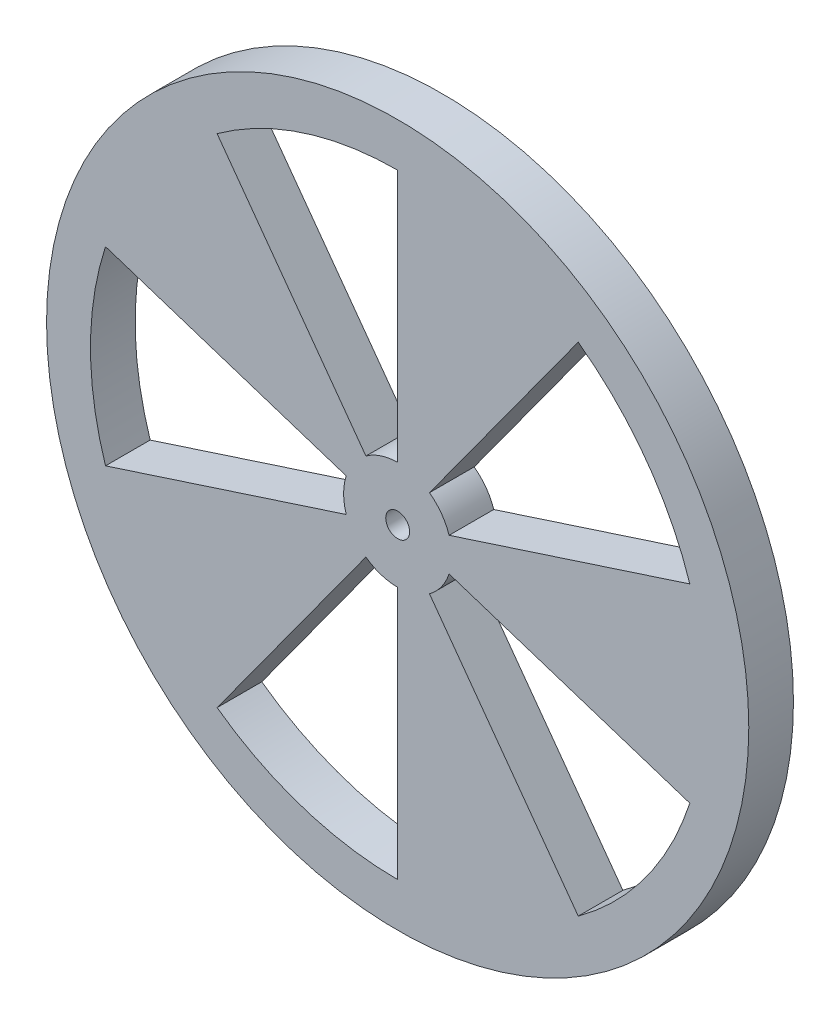
from build123d import *

# Parameters (mm, degrees)
SKETCH1_R           = 25
SKETCH1_R_2         = 0.85
BOSS_EXTRUDE1_DEPTH = 3.18
CUT_EXTRUDE1_DEPTH  = 36.498061919


with BuildPart() as part:
    # Sketch1 → Boss-Extrude1 (new body)
    with BuildSketch(Plane.XY):
        with Locations(Location((0, 0, 0), (0, 0, 180))):
            Circle(SKETCH1_R)
        with Locations(Location((0, 0, 0), (0, 0, 180))):
            Circle(SKETCH1_R_2, mode=Mode.SUBTRACT)
    extrude(amount=BOSS_EXTRUDE1_DEPTH)

    # Sketch2 → Cut-Extrude1 (cut, through all)
    with BuildSketch(Plane.XY.offset(3.18)):
        with BuildLine():
            ThreePointArc((-2.262973221, 3.114715428), (-1.189715428, 3.661567588), (0, 3.85))
            Line((0, 3.85), (0, 21.87181707))
            ThreePointArc((0, 21.87181707), (-6.758763172, 20.801334147), (-12.855931514, 17.694671707))
            Line((-12.855931514, 17.694671707), (-2.262973221, 3.114715428))
        make_face()
        with BuildLine():
            Line((12.855931514, 17.694671707), (2.262973221, 3.114715428))
            ThreePointArc((2.262973221, 3.114715428), (3.114715428, 2.262973221), (3.661567588, 1.189715428))
            Line((3.661567588, 1.189715428), (20.801334147, 6.758763172))
            ThreePointArc((20.801334147, 6.758763172), (17.694671707, 12.855931514), (12.855931514, 17.694671707))
        make_face()
        with BuildLine():
            ThreePointArc((-3.661567588, -1.189715428), (-3.85, 0), (-3.661567588, 1.189715428))
            Line((-3.661567588, 1.189715428), (-20.801334147, 6.758763172))
            ThreePointArc((-20.801334147, 6.758763172), (-21.87181707, 0), (-20.801334147, -6.758763172))
            Line((-20.801334147, -6.758763172), (-3.661567588, -1.189715428))
        make_face()
        with BuildLine():
            Line((20.801334147, -6.758763172), (3.661567588, -1.189715428))
            ThreePointArc((3.661567588, -1.189715428), (3.114715428, -2.262973221), (2.262973221, -3.114715428))
            Line((2.262973221, -3.114715428), (12.855931514, -17.694671707))
            ThreePointArc((12.855931514, -17.694671707), (17.694671707, -12.855931514), (20.801334147, -6.758763172))
        make_face()
        with BuildLine():
            ThreePointArc((0, -3.85), (-1.189715428, -3.661567588), (-2.262973221, -3.114715428))
            Line((-2.262973221, -3.114715428), (-12.855931514, -17.694671707))
            ThreePointArc((-12.855931514, -17.694671707), (-6.758763172, -20.801334147), (0, -21.87181707))
            Line((0, -21.87181707), (0, -3.85))
        make_face()
    extrude(amount=-CUT_EXTRUDE1_DEPTH, mode=Mode.SUBTRACT)


solid = part.part
